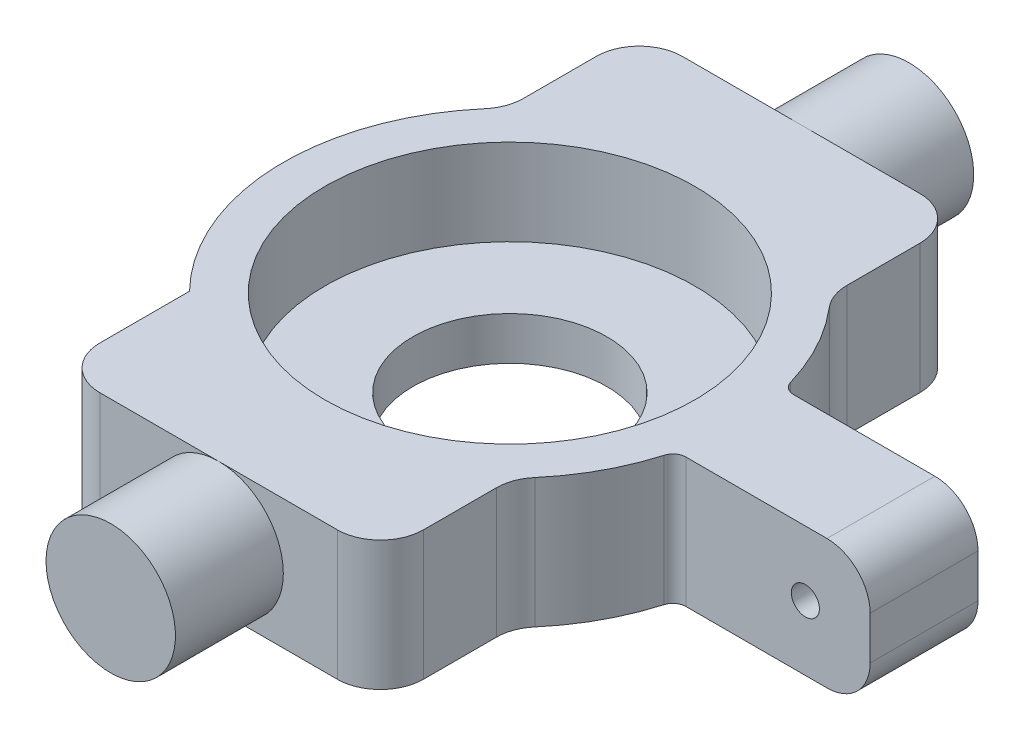
from build123d import *

# Parameters (mm, degrees)
BOSS_EXTRUDE1_DEPTH   = 6
BOSS_EXTRUDE1_2_DEPTH = 6
SKETCH1_3_R           = 10.5
SKETCH1_3_R_2         = 4.5
BOSS_EXTRUDE2_DEPTH   = 2
SKETCH2_R             = 8.575
BOSS_EXTRUDE3_DEPTH   = 4
SKETCH3_R             = 3
BOSS_EXTRUDE4_DEPTH   = 5
BOSS_EXTRUDE5_START   = -6
BOSS_EXTRUDE5_DEPTH   = 6
CUT_EXTRUDE1_REACH    = 31.079
SKETCH5_R             = 0.65
FILLET1_R             = 2
FILLET2_R             = 0.6


with BuildPart() as part:
    # Sketch1 → Boss-Extrude1 (new body)
    with BuildSketch(Plane(origin=(0, 0, 0), x_dir=(1, 0, 0), z_dir=(0, 1, 0))):
        with BuildLine():
            Line((-7.5, 13.5), (-7.5, 7.348469228))
            ThreePointArc((-7.5, 7.348469228), (0, 10.5), (7.5, 7.348469228))
            Line((7.5, 7.348469228), (7.5, 13.5))
            Line((7.5, 13.5), (-7.5, 13.5))
        make_face()
    extrude(amount=BOSS_EXTRUDE1_DEPTH)



with BuildPart() as body_2:
    # Sketch1 → Boss-Extrude1 2 (new body)
    with BuildSketch(Plane(origin=(0, 0, 0), x_dir=(1, 0, 0), z_dir=(0, 1, 0))):
        with BuildLine():
            ThreePointArc((7.5, -7.348469228), (0, -10.5), (-7.5, -7.348469228))
            Line((-7.5, -7.348469228), (-7.5, -13.5))
            Line((-7.5, -13.5), (7.5, -13.5))
            Line((7.5, -13.5), (7.5, -7.348469228))
        make_face()
    extrude(amount=BOSS_EXTRUDE1_2_DEPTH)


with BuildPart() as part_1:
    add(part.part)

    add(body_2.part)  # Boss-Extrude2 merges body 2
    # Sketch1<3> → Boss-Extrude2 (add)
    with BuildSketch(Plane(origin=(0, 0, 0), x_dir=(1, 0, 0), z_dir=(0, 1, 0))):
        Circle(SKETCH1_3_R)
        with Locations(Location((0, 0, 0), (0, 0, 270))):
            Circle(SKETCH1_3_R_2, mode=Mode.SUBTRACT)
    extrude(amount=BOSS_EXTRUDE2_DEPTH)

    # Sketch2 → Boss-Extrude3 (add)
    with BuildSketch(Plane(origin=(0, 2, 0), x_dir=(1, 0, 0), z_dir=(0, 1, 0))):
        with BuildLine():
            ThreePointArc((7.5, 7.348469228), (0, 10.5), (-7.5, 7.348469228))
            ThreePointArc((-7.5, 7.348469228), (-10.5, 0), (-7.5, -7.348469228))
            ThreePointArc((-7.5, -7.348469228), (0, -10.5), (7.5, -7.348469228))
            ThreePointArc((7.5, -7.348469228), (10.5, 0), (7.5, 7.348469228))
        make_face()
        with Locations(Location((0, 0, 0), (0, 0, 270))):
            Circle(SKETCH2_R, mode=Mode.SUBTRACT)
    extrude(amount=BOSS_EXTRUDE3_DEPTH)

    # Sketch3 → Boss-Extrude4 (add)
    with BuildSketch(Plane(origin=(0, 0, -13.5), x_dir=(-1, 0, 0), z_dir=(0, 0, -1))):
        with Locations(Location((0, 3, 0), (0, 0, 270))):
            Circle(SKETCH3_R)
    boss_extrude4 = extrude(amount=BOSS_EXTRUDE4_DEPTH)

    # Mirror1: Boss-Extrude4 across plane
    add(boss_extrude4.mirror(Plane.XY))

    # Sketch4 → Boss-Extrude5 (add)
    with BuildSketch(Plane(origin=(0, 6, 0), x_dir=(1, 0, 0), z_dir=(0, 1, 0)).offset(BOSS_EXTRUDE5_START)):
        with BuildLine():
            Line((10.198039027, -2.5), (19.198039027, -2.5))
            Line((19.198039027, -2.5), (19.198039027, 2.5))
            Line((19.198039027, 2.5), (10.198039027, 2.5))
            ThreePointArc((10.198039027, 2.5), (10.5, 0), (10.198039027, -2.5))
        make_face()
    extrude(amount=BOSS_EXTRUDE5_DEPTH)

    # Sketch5 → Cut-Extrude1 (cut, up to next)
    with BuildSketch(Plane(origin=(0, 0, -2.5), x_dir=(-1, 0, 0), z_dir=(0, 0, -1)), mode=Mode.PRIVATE) as cut_extrude1_sk1:
        with Locations((-16.198039027, 3)):
            Circle(SKETCH5_R)
    cut_extrude1_tool1 = extrude(cut_extrude1_sk1.sketch, amount=-CUT_EXTRUDE1_REACH, mode=Mode.PRIVATE) & part_1.part
    add(cut_extrude1_tool1.solids().sort_by_distance((16.198039, 3, -2.5))[0], mode=Mode.SUBTRACT)

    # Fillet1
    fillet1_edges = [part_1.edges().sort_by_distance(p)[0] for p in [
        (7.5, 3, 7.348469228),
        (-7.5, 3, 13.5),
        (7.5, 3, 13.5),
        (19.198039027, 6, 0),
        (19.198039027, 0, 0),
        (-7.5, 3, -7.348469228),
        (-7.5, 3, -13.5),
        (7.5, 3, -13.5),
        (7.5, 3, -7.348469228),
    ]]
    fillet(fillet1_edges, radius=FILLET1_R)

    # Fillet2
    fillet2_edges = [part_1.edges().sort_by_distance(p)[0] for p in [
        (10.198039027, 3, 2.5),
        (10.198039027, 3, -2.5),
    ]]
    fillet(fillet2_edges, radius=FILLET2_R)


solid = part_1.part
